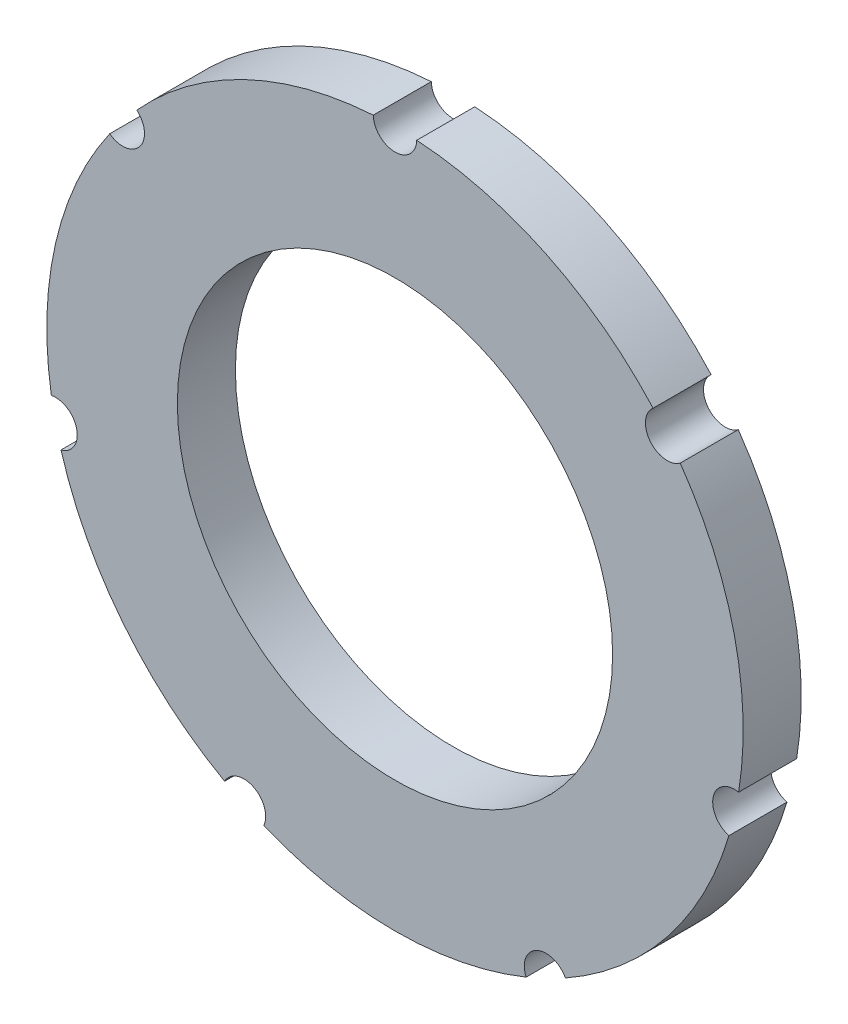
from build123d import *

# Parameters (mm, degrees)
SKETCH1_R           = 15
BOSS_EXTRUDE1_DEPTH = 4


with BuildPart() as part:
    # Sketch1 → Boss-Extrude1 (new body)
    with BuildSketch(Plane.XY):
        with BuildLine():
            ThreePointArc((-1.499267399, 23.953125), (-10.413209739, 21.62325283), (-17.792529295, 16.106703613))
            ThreePointArc((-17.792529295, 16.106703613), (-17.591208356, 14.028520542), (-19.662085162, 13.762354707))
            ThreePointArc((-19.662085162, 13.762354707), (-23.398269892, 5.340502415), (-23.686188528, -3.868394111))
            ThreePointArc((-23.686188528, -3.868394111), (-21.935878024, -5.006721014), (-23.018951765, -6.791749381))
            ThreePointArc((-23.018951765, -6.791749381), (-18.763955579, -14.963755245), (-11.74366469, -20.930512169))
            ThreePointArc((-11.74366469, -20.930512169), (-9.76238413, -20.271799528), (-9.042078187, -22.231527659))
            ThreePointArc((-9.042078187, -22.231527659), (0, -24), (9.042078187, -22.231527659))
            ThreePointArc((9.042078187, -22.231527659), (9.76238413, -20.271799528), (11.74366469, -20.930512169))
            ThreePointArc((11.74366469, -20.930512169), (18.763955579, -14.963755245), (23.018951765, -6.791749381))
            ThreePointArc((23.018951765, -6.791749381), (21.935878024, -5.006721014), (23.686188528, -3.868394111))
            ThreePointArc((23.686188528, -3.868394111), (23.398269892, 5.340502415), (19.662085162, 13.762354707))
            ThreePointArc((19.662085162, 13.762354707), (17.591208356, 14.028520542), (17.792529295, 16.106703613))
            ThreePointArc((17.792529295, 16.106703613), (10.413209739, 21.62325283), (1.499267399, 23.953125))
            ThreePointArc((1.499267399, 23.953125), (0, 22.5), (-1.499267399, 23.953125))
        make_face()
        Circle(SKETCH1_R, mode=Mode.SUBTRACT)
    extrude(amount=BOSS_EXTRUDE1_DEPTH)


solid = part.part
